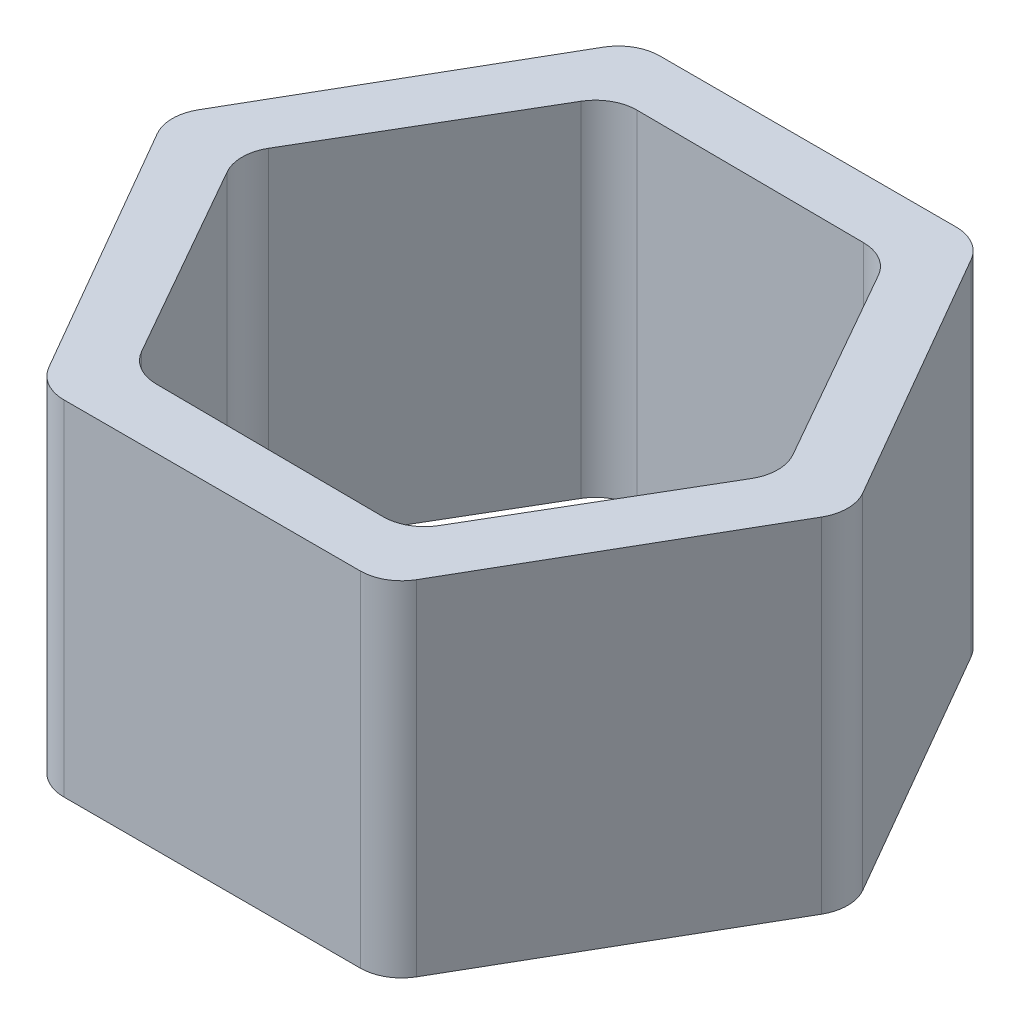
from build123d import *

# Parameters (mm, degrees)
SALIENTE_EXTRUIR2_DEPTH = 100
CORTAR_EXTRUIR1_DEPTH   = 100
REDONDEO1_R             = 12
REDONDEO2_R             = 12


with BuildPart() as part:
    # Croquis1 → Saliente-Extruir2 (new body)
    with BuildSketch(Plane(origin=(0, 0, 0), x_dir=(1, 0, 0), z_dir=(0, 1, 0))):
        Polygon((-50, -86.602540378), (50, -86.602540378), (100, 0), (50, 86.602540378), (-50, 86.602540378), (-100, 0), align=None)
    extrude(amount=SALIENTE_EXTRUIR2_DEPTH)

    # Croquis3 → Cortar-Extruir1 (cut)
    with BuildSketch(Plane(origin=(0, 100, 0), x_dir=(1, 0, 0), z_dir=(0, 1, 0))):
        Polygon((39.613585437, -69.686093894), (80.156720321, -0.536675623), (40.543134884, 69.14941827), (-39.613585437, 69.686093894), (-80.156720321, 0.536675623), (-40.543134884, -69.14941827), align=None)
    extrude(amount=-CORTAR_EXTRUIR1_DEPTH, mode=Mode.SUBTRACT)

    # Redondeo1
    redondeo1_edges = [part.edges().sort_by_distance(p)[0] for p in [
        (-100, 50, 0),
        (-50, 50, -86.602540378),
        (50, 50, -86.602540378),
        (100, 50, 0),
        (50, 50, 86.602540378),
        (-50, 50, 86.602540378),
    ]]
    fillet(redondeo1_edges, radius=REDONDEO1_R)

    # Redondeo2
    redondeo2_edges = [part.edges().sort_by_distance(p)[0] for p in [
        (39.613585437, 50, 69.686093894),
        (-40.543134884, 50, 69.14941827),
        (-80.156720321, 50, -0.536675623),
        (-39.613585437, 50, -69.686093894),
        (40.543134884, 50, -69.14941827),
        (80.156720321, 50, 0.536675623),
    ]]
    fillet(redondeo2_edges, radius=REDONDEO2_R)


solid = part.part
